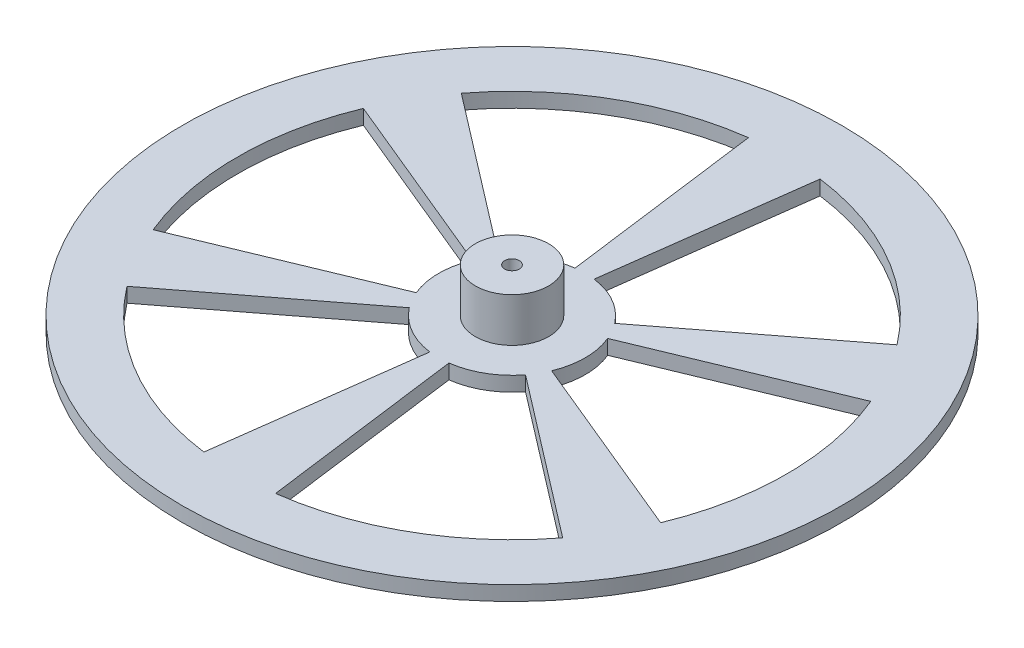
from build123d import *

# Parameters (mm, degrees)
SKETCH_1_R               = 90
EXTRUDE_1_DEPTH          = 4
CUT_EXTRUDE_1_DEPTH      = 128.342059038
PATTERN_CIRCULAR_1_COUNT = 6
SKETCH_6_R               = 10
EXTRUDE_2_DEPTH          = 12
SKETCH_7_R               = 2
CUT_EXTRUDE_2_DEPTH      = 12


with BuildPart() as part:
    # 草图1 → 凸台-拉伸1 (new body)
    with BuildSketch(Plane(origin=(0, 0, 0), x_dir=(1, 0, 0), z_dir=(0, 1, 0))):
        Circle(SKETCH_1_R)
    extrude(amount=EXTRUDE_1_DEPTH)

    # 草图2 → 切除-拉伸1 (cut, through all)
    with BuildSketch(Plane(origin=(0, 4, 0), x_dir=(1, 0, 0), z_dir=(0, 1, 0))):
        with BuildLine():
            ThreePointArc((-15.867066806, 12.17522858), (-10, 17.320508076), (-2.610523844, 19.828897227))
            Line((-2.610523844, 19.828897227), (-9.789464417, 74.358364603))
            ThreePointArc((-9.789464417, 74.358364603), (-37.5, 64.951905284), (-59.501500522, 45.657107176))
            Line((-59.501500522, 45.657107176), (-15.867066806, 12.17522858))
        make_face()
    cut_extrude_1 = extrude(amount=-CUT_EXTRUDE_1_DEPTH, mode=Mode.SUBTRACT)

    # 阵列(圆周)1: 切除-拉伸1 ×6 about axis
    pattern_circular_1_axis = Axis((0, 4, 0), (0, 1, 0))
    for i in range(1, PATTERN_CIRCULAR_1_COUNT):
        add(cut_extrude_1.rotate(pattern_circular_1_axis, i * 360 / PATTERN_CIRCULAR_1_COUNT), mode=Mode.SUBTRACT)

    # 草图6 → 凸台-拉伸2 (add)
    with BuildSketch(Plane(origin=(0, 4, 0), x_dir=(1, 0, 0), z_dir=(0, 1, 0))):
        Circle(SKETCH_6_R)
    extrude(amount=EXTRUDE_2_DEPTH)

    # 草图7 → 切除-拉伸2 (cut)
    with BuildSketch(Plane(origin=(0, 16, 0), x_dir=(1, 0, 0), z_dir=(0, 1, 0))):
        Circle(SKETCH_7_R)
    extrude(amount=-CUT_EXTRUDE_2_DEPTH, mode=Mode.SUBTRACT)


solid = part.part
